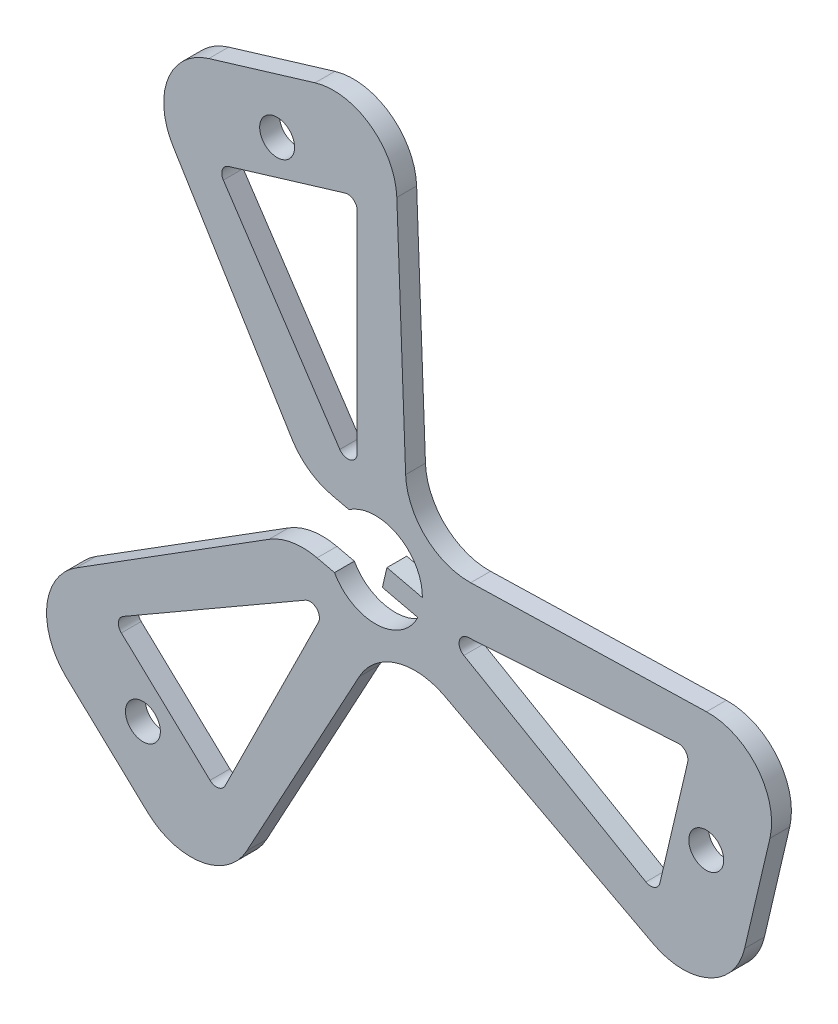
from build123d import *

# Parameters (mm, degrees)
SKETCH1_R           = 3.7592
SKETCH1_R_2         = 1.397
BOSS_EXTRUDE1_DEPTH = 1.5875
CUT_EXTRUDE1_DEPTH  = 83.87509024
FILLET1_R           = 5.08
FILLET2_R           = 5.08
CUT_EXTRUDE2_REACH  = 82.757
BOSS_EXTRUDE2_DEPTH = 1.5875
FILLET3_R           = 5.08
CUT_EXTRUDE3_REACH  = 82.757
FILLET4_R           = 0.762


with BuildPart() as part:
    # Sketch1 → Boss-Extrude1 (new body)
    with BuildSketch(Plane.XY):
        Polygon((59.817595463, 0.441306322), (64.845697084, 21.910029909), (33.226760771, 51.582904103), (12.120249948, 45.203006047), (2.232255249, 2.983766862), (18.31066445, -12.105058669), align=None)
        with Locations((31.758870494, 18.335992429)):
            Circle(SKETCH1_R, mode=Mode.SUBTRACT)
        with Locations((13.143651596, -1.500084688)):
            Circle(SKETCH1_R_2, mode=Mode.SUBTRACT)
        with Locations((58.245026637, 12.132778525)):
            Circle(SKETCH1_R_2, mode=Mode.SUBTRACT)
        with Locations((23.887933249, 44.37528345)):
            Circle(SKETCH1_R_2, mode=Mode.SUBTRACT)
    extrude(amount=BOSS_EXTRUDE1_DEPTH)

    # Sketch2 → Cut-Extrude1 (cut, through all)
    with BuildSketch(Plane(origin=(0, 0, 0), x_dir=(-1, 0, 0), z_dir=(0, 0, -1))):
        Polygon((-33.226760771, 51.582904103), (-64.845697084, 21.910029909), (-34.366094464, 21.114208254), align=None)
        Polygon((-28.049253027, 19.204806708), (-2.232255249, 2.983766862), (-12.120249948, 45.203006047), align=None)
        Polygon((-32.861263991, 14.688962325), (-18.31066445, -12.105058669), (-59.817595463, 0.441306322), align=None)
    extrude(amount=-CUT_EXTRUDE1_DEPTH, mode=Mode.SUBTRACT)

    # Fillet1
    fillet1_edges = [part.edges().sort_by_distance(p)[0] for p in [
        (34.366094464, 21.114208254, 0.79375),
        (28.049253027, 19.204806708, 0.79375),
        (32.861263991, 14.688962325, 0.79375),
    ]]
    fillet(fillet1_edges, radius=FILLET1_R)

    # Fillet2
    fillet2_edges = [part.edges().sort_by_distance(p)[0] for p in [
        (18.31066445, -12.105058669, 0.79375),
        (2.232255249, 2.983766862, 0.79375),
        (12.120249948, 45.203006047, 0.79375),
        (33.226760771, 51.582904103, 0.79375),
        (64.845697084, 21.910029909, 0.79375),
        (59.817595463, 0.441306322, 0.79375),
    ]]
    fillet(fillet2_edges, radius=FILLET2_R)

    # Sketch3 → Cut-Extrude2 (cut, up to next)
    with BuildSketch(Plane(origin=(0, 0, 0), x_dir=(-1, 0, 0), z_dir=(0, 0, -1)), mode=Mode.PRIVATE) as cut_extrude2_sk1:
        with BuildLine():
            ThreePointArc((-27.999670494, 18.335992429), (-28.12209579, 17.384438756), (-28.481397666, 16.494863291))
            Line((-28.481397666, 16.494863291), (-24.797711818, 17.357604232))
            ThreePointArc((-24.797711818, 17.357604232), (-26.039580674, 19.67548382), (-25.956130857, 22.303760854))
            Line((-25.956130857, 22.303760854), (-29.639816705, 21.441019913))
            ThreePointArc((-29.639816705, 21.441019913), (-28.434902109, 20.091788208), (-27.999670494, 18.335992429))
        make_face()
    cut_extrude2_tool1 = extrude(cut_extrude2_sk1.sketch, amount=-CUT_EXTRUDE2_REACH, mode=Mode.PRIVATE) & part.part
    add(cut_extrude2_tool1.solids().sort_by_distance((27.120451, 19.422338, 0))[0], mode=Mode.SUBTRACT)

    # Sketch4 → Boss-Extrude2 (add)
    with BuildSketch(Plane.XY.offset(1.5875)):
        Polygon((32.680495966, 18.941790424), (35.601454601, 18.257684693), (35.236598188, 16.699839988), (32.315639553, 17.383945719), align=None)
    extrude(amount=-BOSS_EXTRUDE2_DEPTH)

    # Fillet3
    fillet3_edges = [part.edges().sort_by_distance(p)[0] for p in [
        (25.956130857, 22.303760854, 0.79375),
        (24.797711818, 17.357604232, 0.79375),
    ]]
    fillet(fillet3_edges, radius=FILLET3_R)

    # Sketch5 → Cut-Extrude3 (cut, up to next)
    with BuildSketch(Plane.XY.offset(1.5875), mode=Mode.PRIVATE) as cut_extrude3_sk1:
        Polygon((30.303711078, 23.150072166), (30.303711078, 43.528414036), (19.015506314, 40.116310717), align=None)
    cut_extrude3_tool1 = extrude(cut_extrude3_sk1.sketch, amount=-CUT_EXTRUDE3_REACH, mode=Mode.PRIVATE) & part.part
    # Sketch5 → Cut-Extrude3 (cut, up to next)
    with BuildSketch(Plane.XY.offset(1.5875), mode=Mode.PRIVATE) as cut_extrude3_sk2:
        Polygon((36.65556555, 17.189157581), (54.303727297, 6.999986646), (56.992861524, 18.481910394), align=None)
    cut_extrude3_tool2 = extrude(cut_extrude3_sk2.sketch, amount=-CUT_EXTRUDE3_REACH, mode=Mode.PRIVATE) & part.part
    # Sketch5 → Cut-Extrude3 (cut, up to next)
    with BuildSketch(Plane.XY.offset(1.5875), mode=Mode.PRIVATE) as cut_extrude3_sk3:
        Polygon((28.317334854, 14.66874754), (10.669173107, 4.479576605), (19.268243644, -3.590243825), align=None)
    cut_extrude3_tool3 = extrude(cut_extrude3_sk3.sketch, amount=-CUT_EXTRUDE3_REACH, mode=Mode.PRIVATE) & part.part
    add(cut_extrude3_tool1.solids().sort_by_distance((26.540976, 35.598266, 1.5875))[0], mode=Mode.SUBTRACT)
    add(cut_extrude3_tool2.solids().sort_by_distance((49.317385, 14.223685, 1.5875))[0], mode=Mode.SUBTRACT)
    add(cut_extrude3_tool3.solids().sort_by_distance((19.418251, 5.186027, 1.5875))[0], mode=Mode.SUBTRACT)

    # Fillet4
    fillet4_edges = [part.edges().sort_by_distance(p)[0] for p in [
        (19.015506314, 40.116310717, 0.79375),
        (30.303711078, 43.528414036, 0.79375),
        (30.303711078, 23.150072166, 0.79375),
        (56.992861524, 18.481910394, 0.79375),
        (54.303727297, 6.999986646, 0.79375),
        (36.65556555, 17.189157581, 0.79375),
        (19.268243644, -3.590243825, 0.79375),
        (10.669173107, 4.479576605, 0.79375),
        (28.317334854, 14.66874754, 0.79375),
    ]]
    fillet(fillet4_edges, radius=FILLET4_R)


solid = part.part
